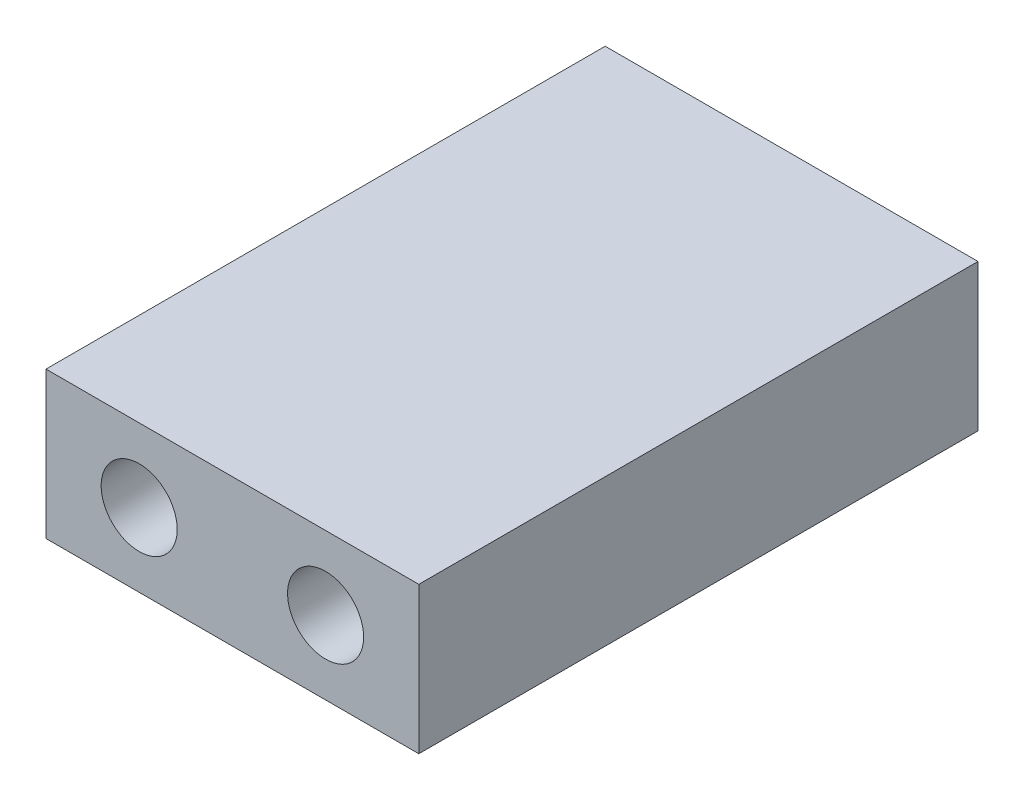
from build123d import *

# Parameters (mm, degrees)
SKETCH2_W                  = 25.4
SKETCH2_H                  = 10
BOSS_EXTRUDE1_DEPTH        = 38.1
F_6_0_204_DIAMETER_HOLE1_D = 5.1816


with BuildPart() as part:
    # Sketch2 → Boss-Extrude1 (new body)
    with BuildSketch(Plane.XY):
        with Locations((12.7, 5)):
            Rectangle(SKETCH2_W, SKETCH2_H)
    extrude(amount=BOSS_EXTRUDE1_DEPTH)

    # #6 (0.204) Diameter Hole1 (through all)
    with Locations(Plane.XY.offset(38.1)):
        with Locations((19.05, 5), (6.35, 5)):
            Hole(F_6_0_204_DIAMETER_HOLE1_D / 2)


solid = part.part
